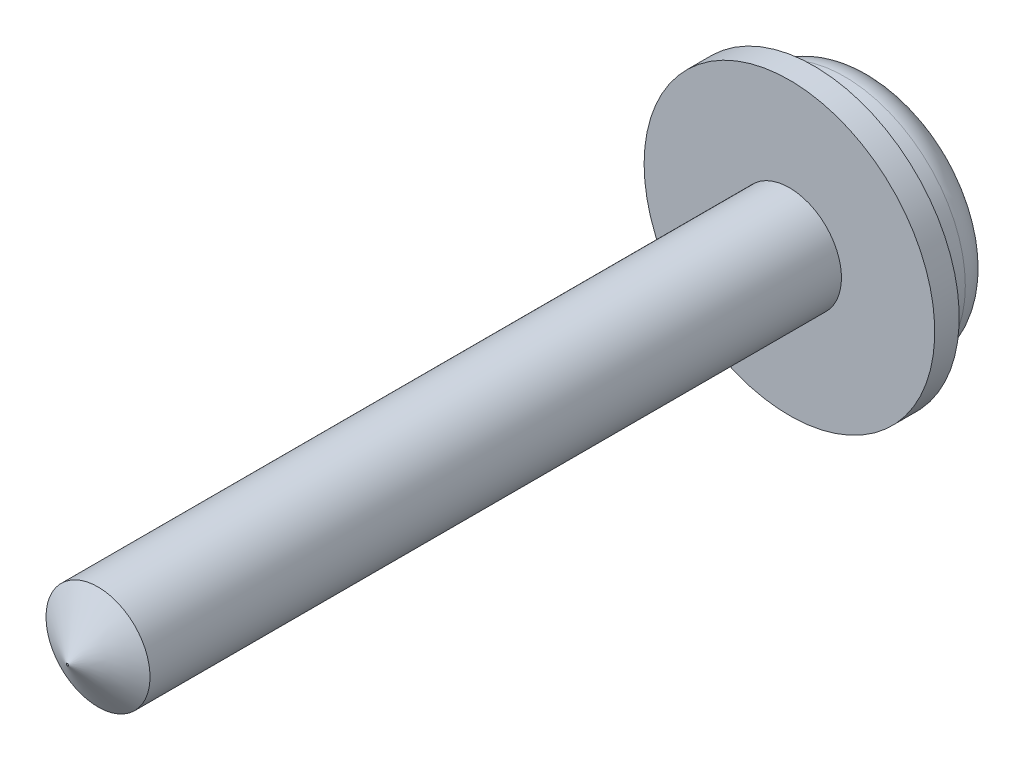
from build123d import *

# Parameters (mm, degrees)
ESBO_O1_R                = 0.85
RESSALTO_EXTRUS_O1_DEPTH = 11.8
CHANFRO1_SIZE            = 0.5
CHANFRO1_SIZE2           = 0.832139741
ESBO_O2_R                = 2.375
RESSALTO_EXTRUS_O2_DEPTH = 0.4
ESBO_O3_R                = 1.975
RESSALTO_EXTRUS_O3_DEPTH = 1
FILETE1_R                = 0.5
CORTE_EXTRUS_O1_DEPTH    = 1


with BuildPart() as part:
    # Esboço1 → Ressalto-extrusão1 (new body)
    with BuildSketch(Plane.XY):
        Circle(ESBO_O1_R)
    extrude(amount=RESSALTO_EXTRUS_O1_DEPTH)

    # Chanfro1
    chanfro1_edges = [part.edges().sort_by_distance(p)[0] for p in [
        (-0.85, 0, 11.8),
    ]]
    chanfro1_side = [part.faces().sort_by_distance(p)[0] for p in [
        (-0.85, 0, 5.9),
    ]]
    chamfer(chanfro1_edges, length=CHANFRO1_SIZE, length2=CHANFRO1_SIZE2, reference=chanfro1_side[0])

    # Esboço2 → Ressalto-extrusão2 (add)
    with BuildSketch(Plane(origin=(0, 0, 0), x_dir=(-1, 0, 0), z_dir=(0, 0, -1))):
        Circle(ESBO_O2_R)
    extrude(amount=RESSALTO_EXTRUS_O2_DEPTH)

    # Esboço3 → Ressalto-extrusão3 (add)
    with BuildSketch(Plane(origin=(0, 0, -0.4), x_dir=(-1, 0, 0), z_dir=(0, 0, -1))):
        Circle(ESBO_O3_R)
    extrude(amount=RESSALTO_EXTRUS_O3_DEPTH)

    # Filete1
    filete1_edges = [part.edges().sort_by_distance(p)[0] for p in [
        (1.975, 0, -1.4),
    ]]
    fillet(filete1_edges, radius=FILETE1_R)

    # Esboço4 → Corte-extrusão1 (cut)
    with BuildSketch(Plane(origin=(0, 0, -1.4), x_dir=(-1, 0, 0), z_dir=(0, 0, -1))):
        with BuildLine():
            Line((-0.6, 0.3), (-1.15, 0.3))
            Line((-1.15, 0.3), (-1.15, -0.3))
            Line((-1.15, -0.3), (-0.6, -0.3))
            ThreePointArc((-0.6, -0.3), (-0.387867966, -0.387867966), (-0.3, -0.6))
            Line((-0.3, -0.6), (-0.3, -1.15))
            Line((-0.3, -1.15), (0.3, -1.15))
            Line((0.3, -1.15), (0.3, -0.6))
            ThreePointArc((0.3, -0.6), (0.387867966, -0.387867966), (0.6, -0.3))
            Line((0.6, -0.3), (1.15, -0.3))
            Line((1.15, -0.3), (1.15, 0.3))
            Line((1.15, 0.3), (0.6, 0.3))
            ThreePointArc((0.6, 0.3), (0.387867966, 0.387867966), (0.3, 0.6))
            Line((0.3, 0.6), (0.3, 1.15))
            Line((0.3, 1.15), (-0.3, 1.15))
            Line((-0.3, 1.15), (-0.3, 0.6))
            ThreePointArc((-0.3, 0.6), (-0.387867966, 0.387867966), (-0.6, 0.3))
        make_face()
    extrude(amount=-CORTE_EXTRUS_O1_DEPTH, mode=Mode.SUBTRACT)


solid = part.part
